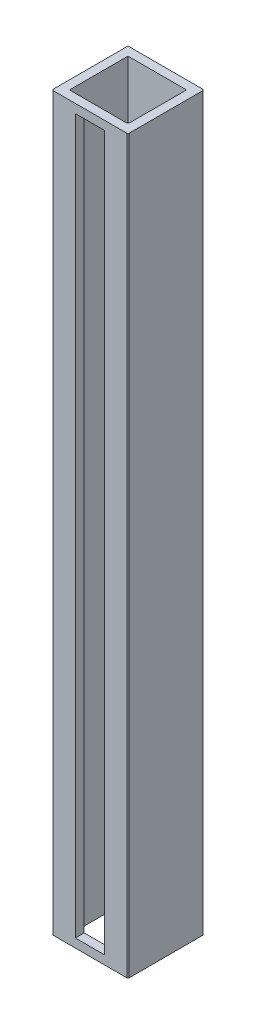
from build123d import *

# Parameters (mm, degrees)
SKETCH1_W           = 26
SKETCH1_H           = 26
BOSS_EXTRUDE1_DEPTH = 250
SHELL1_T            = -3
SKETCH2_W           = 10
SKETCH2_H           = 244
CUT_EXTRUDE1_DEPTH  = 3
CHAMFER1_SIZE       = 0.3


with BuildPart() as part:
    # Sketch1 → Boss-Extrude1 (new body)
    with BuildSketch(Plane(origin=(0, 0, 0), x_dir=(1, 0, 0), z_dir=(0, 1, 0))):
        Rectangle(SKETCH1_W, SKETCH1_H)
    extrude(amount=BOSS_EXTRUDE1_DEPTH)

    # Shell1
    shell1_openings = [part.faces().sort_by_distance(p)[0] for p in [
        (0, 250, 0),
        (0, 0, 0),
    ]]
    offset(amount=SHELL1_T, openings=shell1_openings, kind=Kind.INTERSECTION)

    # Sketch2 → Cut-Extrude1 (cut)
    with BuildSketch(Plane.XY.offset(13)):
        with Locations((0, 125)):
            Rectangle(SKETCH2_W, SKETCH2_H)
    extrude(amount=-CUT_EXTRUDE1_DEPTH, mode=Mode.SUBTRACT)

    # Chamfer1
    chamfer1_edges = [part.edges().sort_by_distance(p)[0] for p in [
        (10, 125, 10),
        (13, 125, 13),
        (-13, 125, 13),
        (13, 125, -13),
    ]]
    chamfer(chamfer1_edges, length=CHAMFER1_SIZE)


solid = part.part
